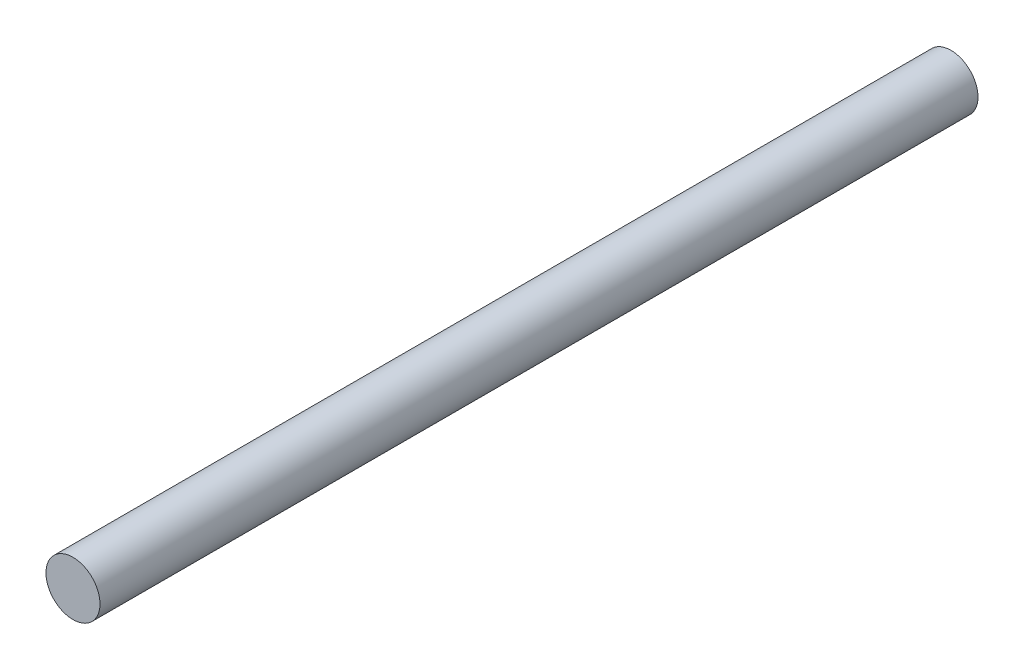
from build123d import *

# Parameters (mm, degrees)
ESQUISSE1_R        = 4
BOSS_EXTRU_1_DEPTH = 130


with BuildPart() as part:
    # Esquisse1 → Boss.-Extru.1 (new body)
    with BuildSketch(Plane.XY):
        Circle(ESQUISSE1_R)
    extrude(amount=BOSS_EXTRU_1_DEPTH)


solid = part.part
